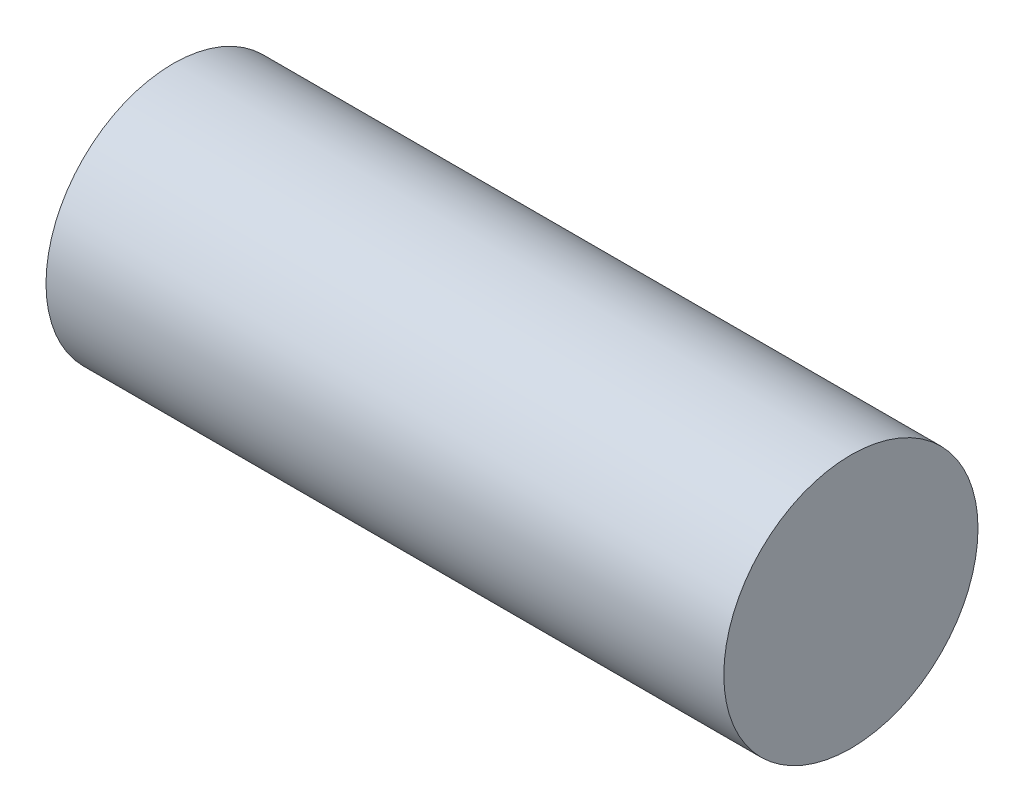
from build123d import *

# Parameters (mm, degrees)
SKETCH1_R           = 6
BOSS_EXTRUDE1_DEPTH = 32


with BuildPart() as part:
    # Sketch1 → Boss-Extrude1 (new body)
    with BuildSketch(Plane(origin=(0, 0, 0), x_dir=(0, 0, -1), z_dir=(1, 0, 0))):
        Circle(SKETCH1_R)
    extrude(amount=BOSS_EXTRUDE1_DEPTH)


solid = part.part
